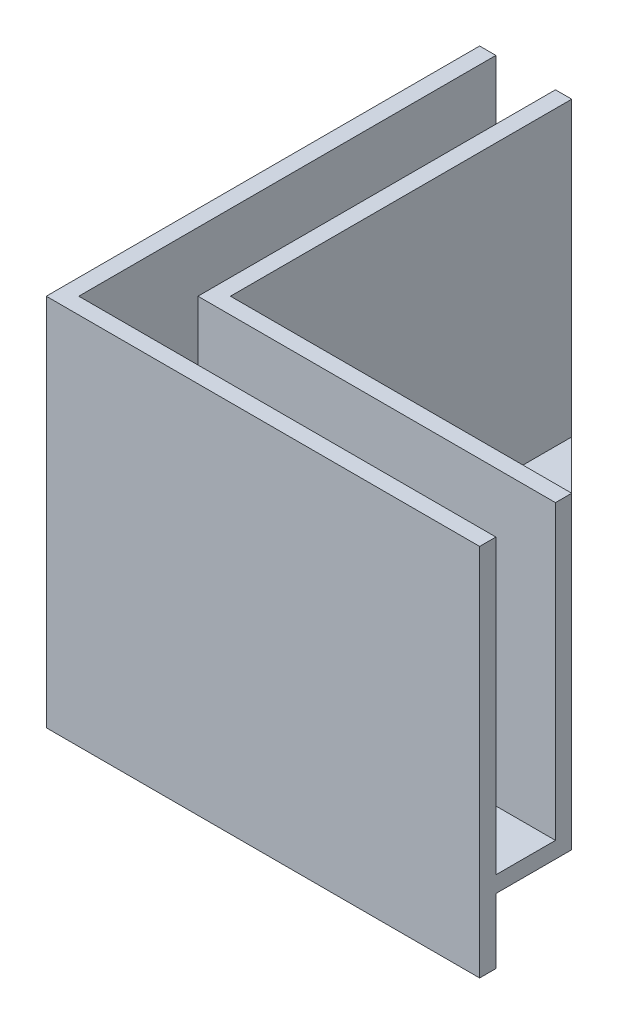
from build123d import *

# Parameters (mm, degrees)
BOSS_EXTRUDE1_DEPTH = 0.75
BOSS_EXTRUDE2_DEPTH = 13.5
SKETCH4_W           = 20
SKETCH4_H           = 20
BOSS_EXTRUDE3_DEPTH = 0.75
BOSS_EXTRUDE7_DEPTH = 3
CUT_EXTRUDE1_DEPTH  = 32.340867888


with BuildPart() as part:
    # Sketch1 → Boss-Extrude1 (new body)
    with BuildSketch(Plane(origin=(0, 0, 0), x_dir=(1, 0, 0), z_dir=(0, 1, 0))):
        Polygon((0, 0), (0, 20), (4.25, 20), (4.25, 4.25), (20, 4.25), (20, 0), align=None)
    extrude(amount=BOSS_EXTRUDE1_DEPTH)

    # Sketch2 → Boss-Extrude2 (add)
    with BuildSketch(Plane(origin=(0, 0.75, 0), x_dir=(1, 0, 0), z_dir=(0, 1, 0))):
        Polygon((20, 3.5), (20, 4.25), (4.25, 4.25), (4.25, 20), (3.5, 20), (3.5, 3.5), align=None)
        Polygon((0.75, 20), (0, 20), (0, 0), (20, 0), (20, 0.75), (0.75, 0.75), align=None)
    extrude(amount=BOSS_EXTRUDE2_DEPTH)

    # Sketch4 → Boss-Extrude3 (add)
    with BuildSketch(Plane.XZ):
        with Locations((10, -10)):
            Rectangle(SKETCH4_W, SKETCH4_H)
    extrude(amount=-BOSS_EXTRUDE3_DEPTH)

    # Sketch7 → Boss-Extrude7 (add)
    with BuildSketch(Plane.XZ):
        Polygon((0, 0), (0, -20), (0.75, -20), (0.75, -0.75), (20, -0.75), (20, 0), align=None)
    extrude(amount=BOSS_EXTRUDE7_DEPTH)

    # Sketch8 → Cut-Extrude1 (cut, through all)
    with BuildSketch(Plane(origin=(0, 0.75, 0), x_dir=(1, 0, 0), z_dir=(0, 1, 0))):
        Polygon((20, 4.25), (20, 20), (4.25, 20), align=None)
    extrude(amount=-CUT_EXTRUDE1_DEPTH, mode=Mode.SUBTRACT)


solid = part.part
